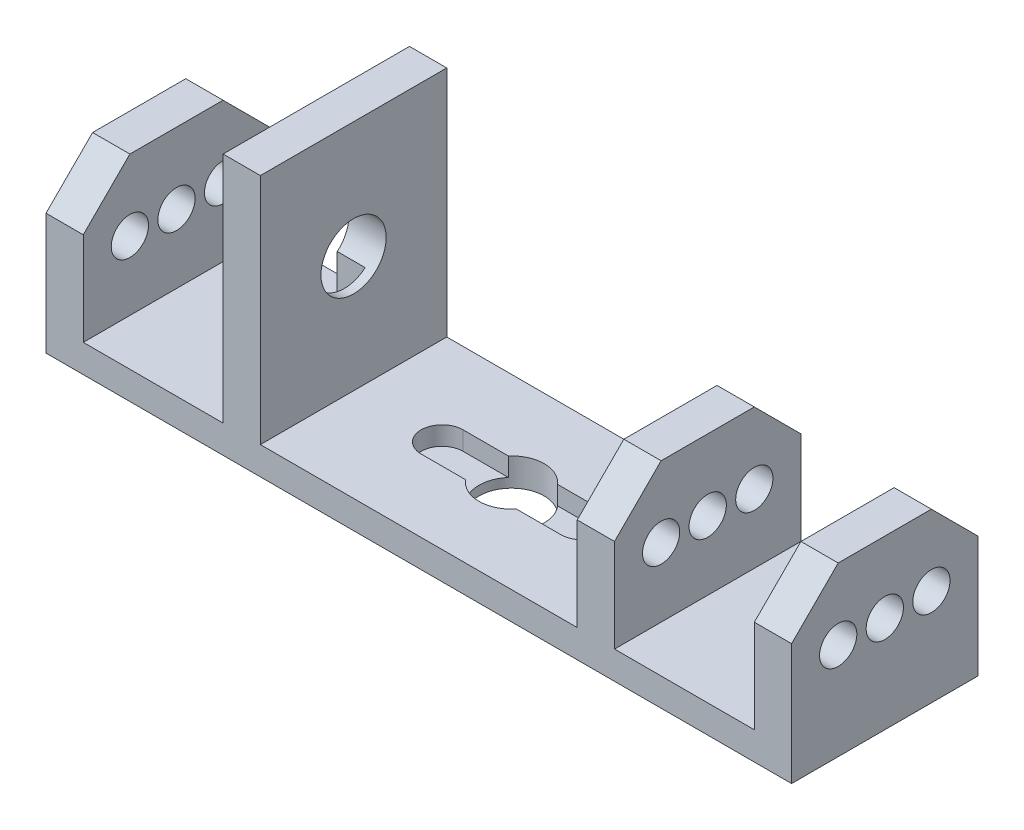
from build123d import *

# Parameters (mm, degrees)
SKETCH_1_W          = 80
SKETCH_1_H          = 20
EXTRUDE_1_DEPTH     = 3
SKETCH_2_R          = 3.5
CUT_EXTRUDE_1_DEPTH = 3
SKETCH_3_W          = 15
SKETCH_3_H          = 4.5
CUT_EXTRUDE_2_DEPTH = 2
SKETCH_5_R          = 2.25
CUT_EXTRUDE_3_DEPTH = 2
SKETCH_6_W          = 4
SKETCH_6_H          = 20
EXTRUDE_2_DEPTH     = 15
CUT_EXTRUDE_4_DEPTH = 83
SKETCH_8_R          = 2
CUT_EXTRUDE_5_DEPTH = 83
SKETCH_9_W          = 4
SKETCH_9_H          = 20
EXTRUDE_3_DEPTH     = 25
SKETCH_10_R         = 3.5
CUT_EXTRUDE_6_DEPTH = 6
SKETCH_11_W         = 4.5
SKETCH_11_H         = 15
CUT_EXTRUDE_7_DEPTH = 3
SKETCH_12_R         = 2.25
CUT_EXTRUDE_8_DEPTH = 3


with BuildPart() as part:
    # 草图1 → 凸台-拉伸1 (new body)
    with BuildSketch(Plane(origin=(0, 0, 0), x_dir=(1, 0, 0), z_dir=(0, 1, 0))):
        with Locations((40, -10)):
            Rectangle(SKETCH_1_W, SKETCH_1_H)
    extrude(amount=EXTRUDE_1_DEPTH)

    # 草图2 → 切除-拉伸1 (cut)
    with BuildSketch(Plane(origin=(0, 3, 0), x_dir=(1, 0, 0), z_dir=(0, 1, 0))):
        with Locations(Location((40, -10.045477327, 0), (0, 0, 270))):
            Circle(SKETCH_2_R)
    extrude(amount=-CUT_EXTRUDE_1_DEPTH, mode=Mode.SUBTRACT)

    # 草图3 → 切除-拉伸2 (cut)
    with BuildSketch(Plane(origin=(0, 3, 0), x_dir=(1, 0, 0), z_dir=(0, 1, 0))):
        with Locations((40, -10)):
            Rectangle(SKETCH_3_W, SKETCH_3_H)
    extrude(amount=-CUT_EXTRUDE_2_DEPTH, mode=Mode.SUBTRACT)

    # 草图5 → 切除-拉伸3 (cut)
    with BuildSketch(Plane(origin=(0, 3, 0), x_dir=(1, 0, 0), z_dir=(0, 1, 0))):
        with Locations((32.5, -10)):
            Circle(SKETCH_5_R)
        with Locations((47.5, -10)):
            Circle(SKETCH_5_R)
    extrude(amount=-CUT_EXTRUDE_3_DEPTH, mode=Mode.SUBTRACT)

    # 草图6 → 凸台-拉伸2 (add)
    with BuildSketch(Plane(origin=(0, 3, 0), x_dir=(1, 0, 0), z_dir=(0, 1, 0))):
        with Locations((2, -10)):
            Rectangle(SKETCH_6_W, SKETCH_6_H)
        with Locations((78, -10)):
            Rectangle(SKETCH_6_W, SKETCH_6_H)
        with Locations((59, -10)):
            Rectangle(SKETCH_6_W, SKETCH_6_H)
    extrude(amount=EXTRUDE_2_DEPTH)

    # 草图7 → 切除-拉伸4 (cut)
    with BuildSketch(Plane(origin=(80, 0, 0), x_dir=(0, 0, -1), z_dir=(1, 0, 0))):
        Polygon((-20, 13), (-15, 18), (-20, 18), align=None)
        Polygon((0, 13), (0, 18), (-5, 18), align=None)
    extrude(amount=-CUT_EXTRUDE_4_DEPTH, mode=Mode.SUBTRACT)

    # 草图8 → 切除-拉伸5 (cut)
    with BuildSketch(Plane.ZY):
        with Locations((5, 10.386894075)):
            Circle(SKETCH_8_R)
        with Locations((10, 10.386894075)):
            Circle(SKETCH_8_R)
        with Locations((15, 10.386894075)):
            Circle(SKETCH_8_R)
    extrude(amount=-CUT_EXTRUDE_5_DEPTH, mode=Mode.SUBTRACT)

    # 草图9 → 凸台-拉伸3 (add)
    with BuildSketch(Plane(origin=(0, 3, 0), x_dir=(1, 0, 0), z_dir=(0, 1, 0))):
        with Locations((21, -10)):
            Rectangle(SKETCH_9_W, SKETCH_9_H)
    extrude(amount=EXTRUDE_3_DEPTH)

    # 草图10 → 切除-拉伸6 (cut)
    with BuildSketch(Plane.ZY.offset(-19)):
        with Locations((10, 15.5)):
            Circle(SKETCH_10_R)
    extrude(amount=-CUT_EXTRUDE_6_DEPTH, mode=Mode.SUBTRACT)

    # 草图11 → 切除-拉伸7 (cut)
    with BuildSketch(Plane.ZY.offset(-19)):
        with Locations((10, 15.4)):
            Rectangle(SKETCH_11_W, SKETCH_11_H)
    extrude(amount=-CUT_EXTRUDE_7_DEPTH, mode=Mode.SUBTRACT)

    # 草图12 → 切除-拉伸8 (cut)
    with BuildSketch(Plane.ZY.offset(-19)):
        with Locations((10, 22.9)):
            Circle(SKETCH_12_R)
        with Locations((10, 7.9)):
            Circle(SKETCH_12_R)
    extrude(amount=-CUT_EXTRUDE_8_DEPTH, mode=Mode.SUBTRACT)


solid = part.part
